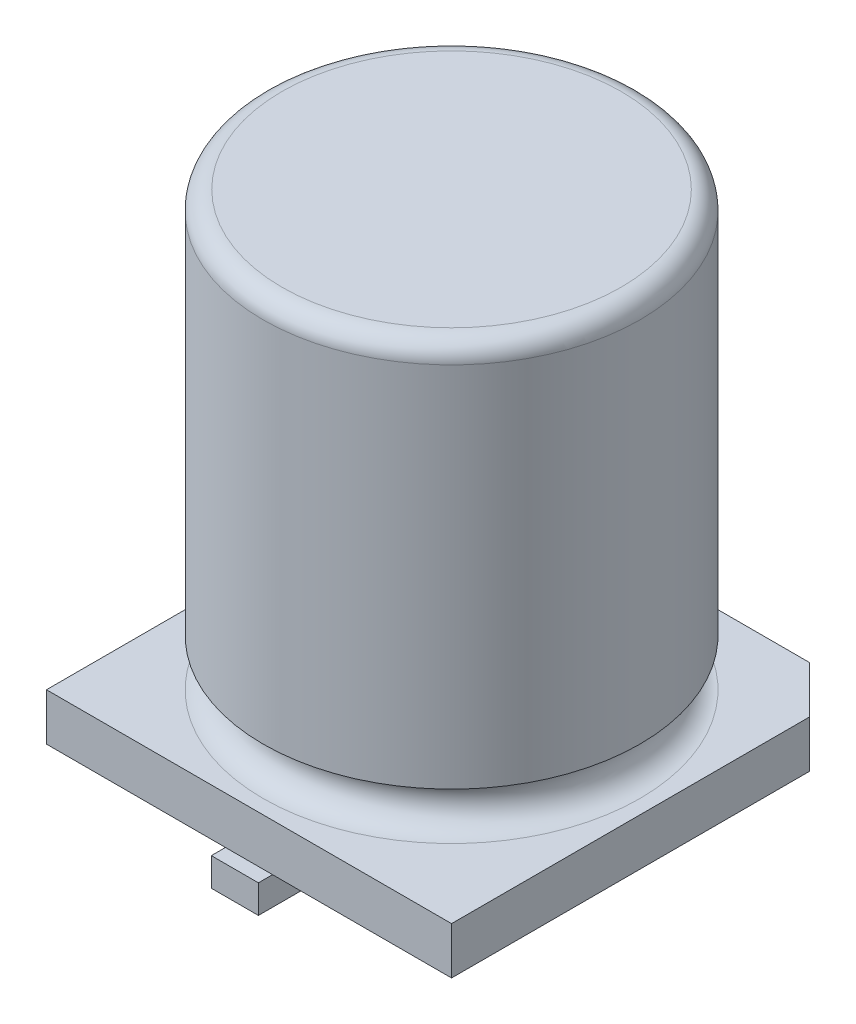
from build123d import *

# Parameters (mm, degrees)
BOSS_EXTRUDE1_DEPTH   = 0.3
BOSS_EXTRUDE1_2_DEPTH = 0.3
BOSS_EXTRUDE2_DEPTH   = 0.5
SKETCH4_R             = 2
BOSS_EXTRUDE3_DEPTH   = 4.6
FILLET1_R             = 0.2
SKETCH6_R             = 0.25


with BuildPart() as part:
    # Sketch1 → Boss-Extrude1 (new body)
    with BuildSketch(Plane(origin=(0, 0, 0), x_dir=(1, 0, 0), z_dir=(0, 1, 0))):
        with BuildLine():
            Line((0.25, 0.75), (0.25, 2.3))
            Line((0.25, 2.3), (-0.25, 2.3))
            Line((-0.25, 2.3), (-0.25, 0.75))
            ThreePointArc((-0.25, 0.75), (0, 0.5), (0.25, 0.75))
        make_face()
    extrude(amount=BOSS_EXTRUDE1_DEPTH)



with BuildPart() as body_2:
    # Sketch1 → Boss-Extrude1 2 (new body)
    with BuildSketch(Plane(origin=(0, 0, 0), x_dir=(1, 0, 0), z_dir=(0, 1, 0))):
        with BuildLine():
            Line((0.25, -0.75), (0.25, -2.3))
            Line((0.25, -2.3), (-0.25, -2.3))
            Line((-0.25, -2.3), (-0.25, -0.75))
            ThreePointArc((-0.25, -0.75), (0, -0.5), (0.25, -0.75))
        make_face()
    extrude(amount=BOSS_EXTRUDE1_2_DEPTH)


with BuildPart() as part_1:
    add(part.part)

    add(body_2.part)  # Boss-Extrude2 merges body 2
    # Sketch3 → Boss-Extrude2 (add)
    with BuildSketch(Plane(origin=(0, 0.3, 0), x_dir=(1, 0, 0), z_dir=(0, 1, 0))):
        Polygon((-2.15, -2.15), (2.15, -2.15), (2.15, 1.65), (1.65, 2.15), (-1.65, 2.15), (-2.15, 1.65), align=None)
    extrude(amount=BOSS_EXTRUDE2_DEPTH)

    # Sketch4 → Boss-Extrude3 (add)
    with BuildSketch(Plane(origin=(0, 0.8, 0), x_dir=(1, 0, 0), z_dir=(0, 1, 0))):
        with Locations(Location((0, 0, 0), (0, 0, 90))):
            Circle(SKETCH4_R)
    extrude(amount=BOSS_EXTRUDE3_DEPTH)

    # Fillet1
    fillet1_edges = [part_1.edges().sort_by_distance(p)[0] for p in [
        (0, 5.4, 2),
    ]]
    fillet(fillet1_edges, radius=FILLET1_R)

    # Sketch6 → Cut-Revolve1 (revolve, cut)
    with BuildSketch(Plane.XY, mode=Mode.PRIVATE) as cut_revolve1_sk:
        with Locations((2, 1.05)):
            Circle(SKETCH6_R)
    revolve(cut_revolve1_sk.sketch.rotate(Axis((0, 0, 0), (0, 1, 0)), 90), axis=Axis((0, 0, 0), (0, 1, 0)), mode=Mode.SUBTRACT)


solid = part_1.part
